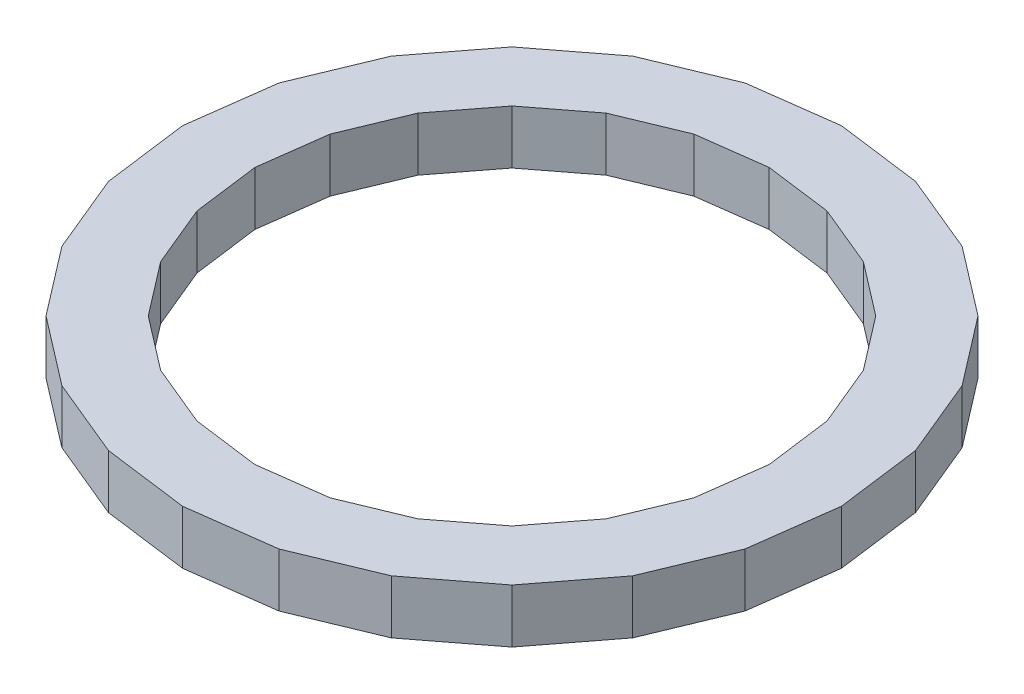
from build123d import *

# Parameters (mm, degrees)
BOSS_EXTRUDE1_DEPTH = 19.05


with BuildPart() as part:
    # Sketch1 → Boss-Extrude1 (new body)
    with BuildSketch(Plane(origin=(0, 0, 0), x_dir=(1, 0, 0), z_dir=(0, 1, 0))):
        Polygon((-116.758175051, 0), (-112.779736712, -30.219239375), (-101.115545694, -58.379087526), (-82.560497338, -82.560497338), (-58.379087526, -101.115545694), (-30.219239375, -112.779736712), (0, -116.758175051), (30.219239375, -112.779736712), (58.379087526, -101.115545694), (82.560497338, -82.560497338), (101.115545694, -58.379087526), (112.779736712, -30.219239375), (116.758175051, 0), (112.779736712, 30.219239375), (101.115545694, 58.379087526), (82.560497338, 82.560497338), (58.379087526, 101.115545694), (30.219239375, 112.779736712), (0, 116.758175051), (-30.219239375, 112.779736712), (-58.379087526, 101.115545694), (-82.560497338, 82.560497338), (-101.115545694, 58.379087526), (-112.779736712, 30.219239375), align=None)
        Polygon((-91.138999452, 0), (-88.033513353, -23.58850881), (-78.928688801, -45.569499726), (-64.445004543, -64.445004543), (-45.569499726, -78.928688801), (-23.58850881, -88.033513353), (0, -91.138999452), (23.58850881, -88.033513353), (45.569499726, -78.928688801), (64.445004543, -64.445004543), (78.928688801, -45.569499726), (88.033513353, -23.58850881), (91.138999452, 0), (88.033513353, 23.58850881), (78.928688801, 45.569499726), (64.445004543, 64.445004543), (45.569499726, 78.928688801), (23.58850881, 88.033513353), (0, 91.138999452), (-23.58850881, 88.033513353), (-45.569499726, 78.928688801), (-64.445004543, 64.445004543), (-78.928688801, 45.569499726), (-88.033513353, 23.58850881), align=None, mode=Mode.SUBTRACT)
    extrude(amount=BOSS_EXTRUDE1_DEPTH)


solid = part.part
